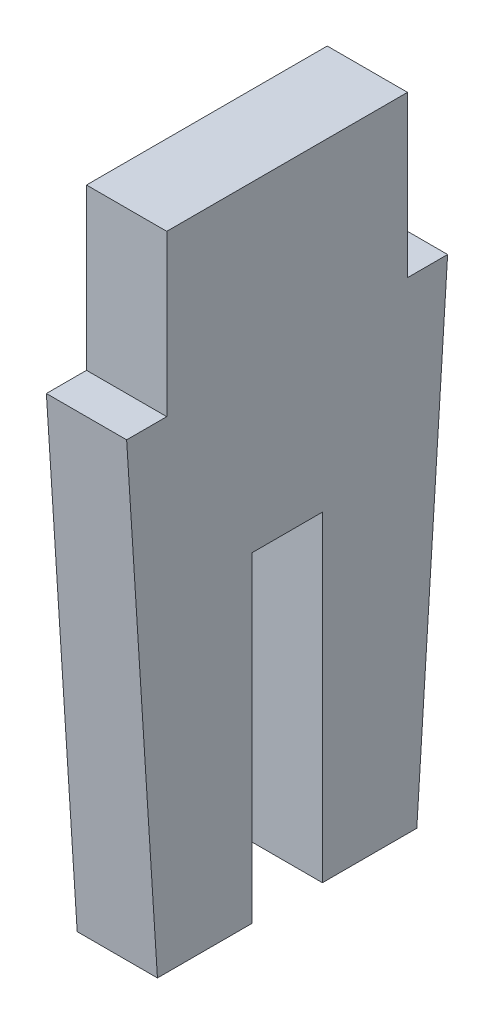
from build123d import *

# Parameters (mm, degrees)
BOSS_EXTRUDE1_DEPTH = 6.35


with BuildPart() as part:
    # Sketch1 → Boss-Extrude1 (new body)
    with BuildSketch(Plane(origin=(0, 0, 0), x_dir=(0, 0, -1), z_dir=(1, 0, 0))):
        Polygon((0, 50.8), (19.05, 50.8), (19.05, 38.1), (22.225, 38.1), (20.193, 6.35), (19.7866, 0), (12.319, 0), (12.319, 25.4), (6.731, 25.4), (6.731, 0), (-0.7366, 0), (-1.143, 6.35), (-3.175, 38.1), (0, 38.1), align=None)
    extrude(amount=BOSS_EXTRUDE1_DEPTH)


solid = part.part
